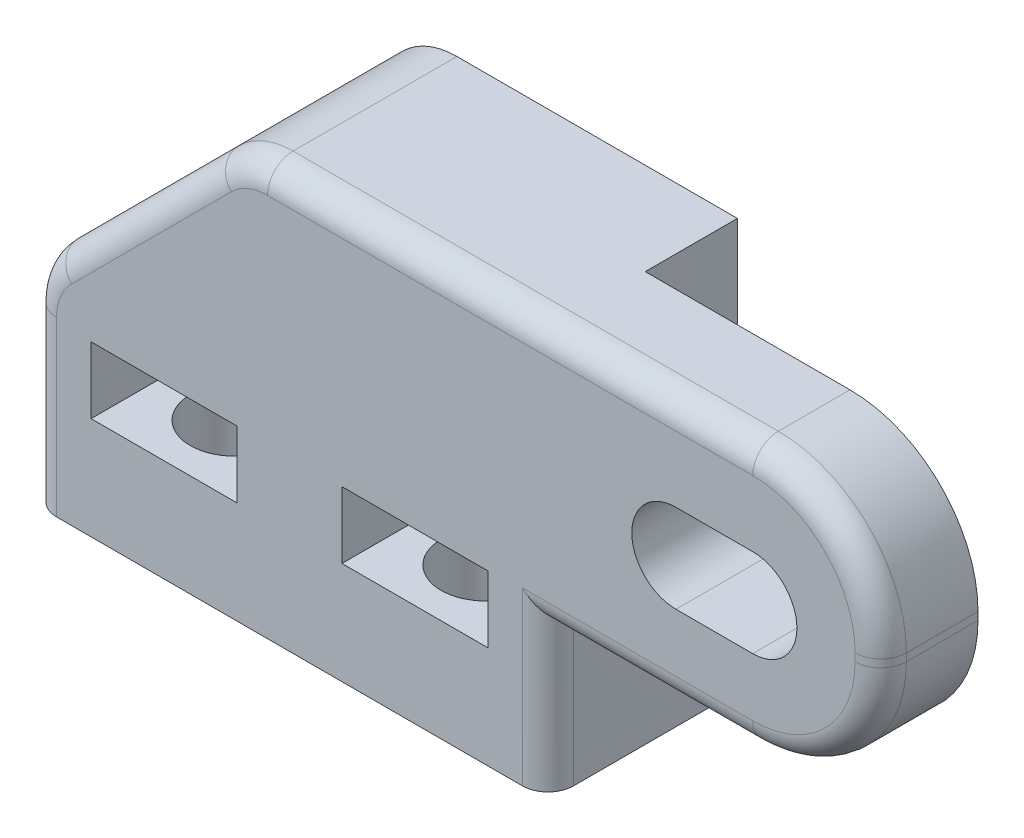
from build123d import *

# Parameters (mm, degrees)
BOSS_EXTRUDE1_DEPTH = 7.4
CUT_EXTRUDE5_REACH  = 39.59
SKETCH2_W           = 3.6
SKETCH2_H           = 10.3
SKETCH4_R           = 1.725
CUT_EXTRUDE3_DEPTH  = 9
SKETCH3_W           = 5.7
SKETCH3_H           = 2.6
CUT_EXTRUDE4_DEPTH  = 38.589892258
CHAMFER1_SIZE       = 8
FILLET4_R           = 3
FILLET5_R           = 5
FILLET6_R           = 1


with BuildPart() as part:
    # Sketch1 → Boss-Extrude1 (new body)
    with BuildSketch(Plane.XY):
        Polygon((0, 0), (20.2, 0), (20.2, 5.7), (33.2, 5.7), (33.2, 16), (0, 16), align=None)
        with BuildLine():
            Line((25.2, 12.425), (28.2, 12.425))
            ThreePointArc((28.2, 12.425), (29.925, 10.7), (28.2, 8.975))
            Line((28.2, 8.975), (25.2, 8.975))
            ThreePointArc((25.2, 8.975), (23.475, 10.7), (25.2, 12.425))
        make_face(mode=Mode.SUBTRACT)
    extrude(amount=BOSS_EXTRUDE1_DEPTH)

    # Cut-Extrude5: up to this face of the body (flat: up to its plane)
    cut_extrude5_end = Plane(part.part.faces().sort_by_distance((20.2, 2.85, 3.7))[0])
    # Sketch2 → Cut-Extrude5 (cut, up to the picked face)
    with BuildSketch(Plane(origin=(33.2, 0, 0), x_dir=(0, 0, -1), z_dir=(1, 0, 0)), mode=Mode.PRIVATE) as cut_extrude5_sk1:
        with Locations((-1.8, 10.85)):
            Rectangle(SKETCH2_W, SKETCH2_H)
    cut_extrude5_tool1 = split(extrude(cut_extrude5_sk1.sketch, amount=-CUT_EXTRUDE5_REACH, mode=Mode.PRIVATE), bisect_by=cut_extrude5_end, keep=Keep.BOTH, mode=Mode.PRIVATE)
    add(cut_extrude5_tool1.solids().sort_by(Axis((33.2, 10.85, 1.8), (-1, 0, 0)))[0], mode=Mode.SUBTRACT)

    # Sketch4 → Cut-Extrude3 (cut)
    with BuildSketch(Plane.XZ):
        with Locations(Location((15, 4.65, 0), (0, 0, 270))):
            Circle(SKETCH4_R)
        with Locations(Location((5.2, 4.65, 0), (0, 0, 270))):
            Circle(SKETCH4_R)
    extrude(amount=-CUT_EXTRUDE3_DEPTH, mode=Mode.SUBTRACT)

    # Sketch3 → Cut-Extrude4 (cut, through all)
    with BuildSketch(Plane(origin=(0, 0, 0), x_dir=(-1, 0, 0), z_dir=(0, 0, -1))):
        with Locations((-15, 5.3)):
            Rectangle(SKETCH3_W, SKETCH3_H)
        with Locations((-5.2, 5.3)):
            Rectangle(SKETCH3_W, SKETCH3_H)
    extrude(amount=-CUT_EXTRUDE4_DEPTH, mode=Mode.SUBTRACT)

    # Chamfer1
    chamfer1_edges = [part.edges().sort_by_distance(p)[0] for p in [
        (0, 16, 3.7),
    ]]
    chamfer(chamfer1_edges, length=CHAMFER1_SIZE)

    # Fillet4
    fillet4_edges = [part.edges().sort_by_distance(p)[0] for p in [
        (8, 16, 3.7),
        (0, 8, 3.7),
    ]]
    fillet(fillet4_edges, radius=FILLET4_R)

    # Fillet5
    fillet5_edges = [part.edges().sort_by_distance(p)[0] for p in [
        (33.2, 16, 5.5),
        (33.2, 5.7, 5.5),
    ]]
    fillet(fillet5_edges, radius=FILLET5_R)

    # Fillet6
    fillet6_edges = [part.edges().sort_by_distance(p)[0] for p in [
        (20.2, 2.85, 7.4),
        (4, 12, 7.4),
        (0, 3.378679656, 7.4),
        (0.228361402, 7.90540961, 7.4),
        (8.09459039, 15.771638598, 7.4),
        (33.2, 10.85, 7.4),
        (18.721320344, 16, 7.4),
        (31.735533906, 14.535533906, 7.4),
        (31.735533906, 7.164466094, 7.4),
        (24.2, 5.7, 7.4),
    ]]
    fillet(fillet6_edges, radius=FILLET6_R)


solid = part.part
